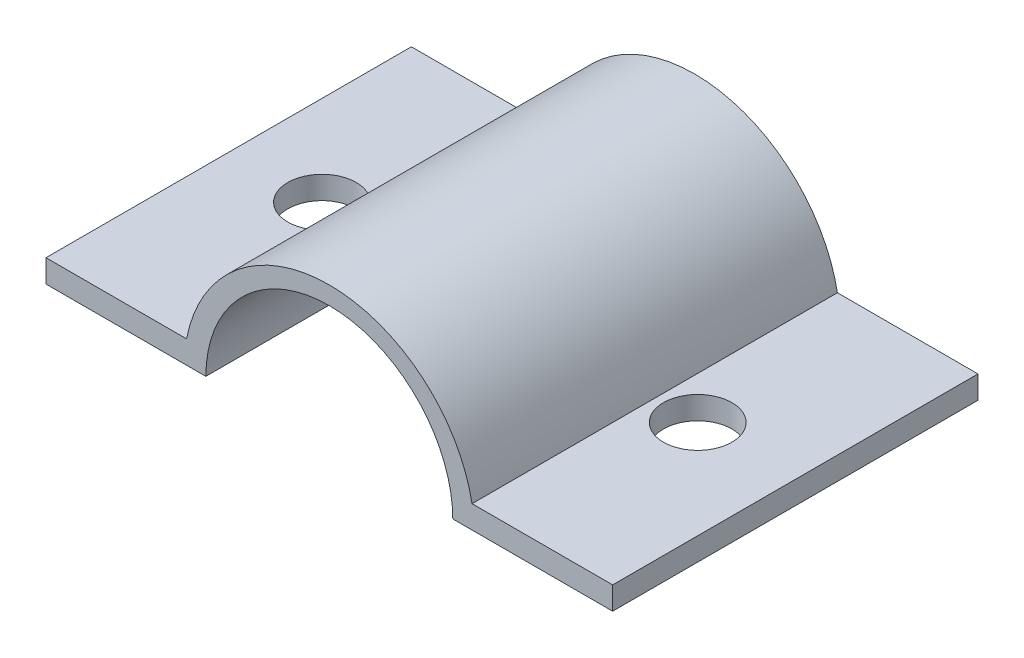
from build123d import *

# Parameters (mm, degrees)
BOSS_EXTRUDE3_DEPTH = 16
SKETCH6_R           = 1.5
CUT_EXTRUDE3_DEPTH  = 6


with BuildPart() as part:
    # Sketch5 → Boss-Extrude3 (new body)
    with BuildSketch(Plane.XY):
        with BuildLine():
            Line((-3.615571451, 0), (-10.615571451, 0))
            Line((-10.615571451, 0), (-10.615571451, 1))
            Line((-10.615571451, 1), (-4.458314558, 1))
            ThreePointArc((-4.458314558, 1), (1.791892926, 6.172463259), (8.04210041, 1))
            Line((8.04210041, 1), (14.199357303, 1))
            Line((14.199357303, 1), (14.199357303, 0))
            Line((14.199357303, 0), (7.199357303, 0))
            ThreePointArc((7.199357303, 0), (1.791892926, 5.3862389), (-3.615571451, 0))
        make_face()
    extrude(amount=BOSS_EXTRUDE3_DEPTH)

    # Sketch6 → Cut-Extrude3 (cut)
    with BuildSketch(Plane(origin=(0, 1, 0), x_dir=(1, 0, 0), z_dir=(0, 1, 0))):
        with Locations(Location((-6.675157332, -7.852450815, 0), (0, 0, 270))):
            Circle(SKETCH6_R)
        with Locations(Location((9.90053709, -7.977048724, 0), (0, 0, 270))):
            Circle(SKETCH6_R)
    extrude(amount=-CUT_EXTRUDE3_DEPTH, mode=Mode.SUBTRACT)


solid = part.part
